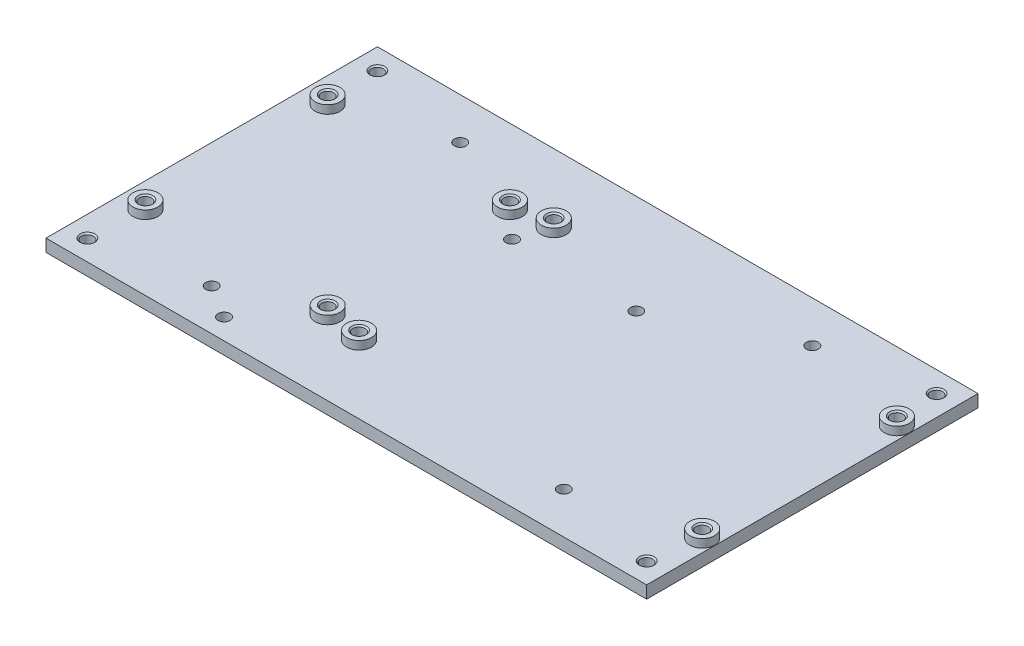
from build123d import *

# Parameters (mm, degrees)
SKETCH_1_W                     = 145
SKETCH_1_H                     = 80
EXTRUDE_1_DEPTH                = 3
SKETCH_3_R                     = 3
EXTRUDE_2_DEPTH                = 2
HOLE_WIZARD_M3_5_4_D           = 2.9
HOLE_WIZARD_M3_5_4_DEPTH       = 11.2
HOLE_WIZARD_M3_5_4_CSINK_D     = 3.55
HOLE_WIZARD_M3_5_4_CSINK_ANGLE = 90
HOLE_WIZARD_M3_5_4_TIP         = 0.871247898
HOLE_WIZARD_M3_5_5_D           = 2.9
HOLE_WIZARD_M3_5_5_DEPTH       = 7
HOLE_WIZARD_M3_5_5_CSINK_D     = 3.55
HOLE_WIZARD_M3_5_5_CSINK_ANGLE = 90
HOLE_WIZARD_M3_5_5_TIP         = 0.871247898
HOLE_WIZARD_M3_5_7_D           = 2.9
HOLE_WIZARD_M3_5_7_CSINK_D     = 3.55
HOLE_WIZARD_M3_5_7_CSINK_ANGLE = 90


with BuildPart() as part:
    # 草图1 → 凸台-拉伸1 (new body)
    with BuildSketch(Plane(origin=(0, 0, 0), x_dir=(1, 0, 0), z_dir=(0, 1, 0))):
        with Locations((72.5, 40)):
            Rectangle(SKETCH_1_W, SKETCH_1_H)
    extrude(amount=EXTRUDE_1_DEPTH)

    # 草图3 → 凸台-拉伸2 (add)
    with BuildSketch(Plane(origin=(0, 3, 0), x_dir=(1, 0, 0), z_dir=(0, 1, 0))):
        with Locations(Location((59.085, 63.5, 0), (0, 0, 90))):
            Circle(SKETCH_3_R)
        with Locations(Location((59.085, 16.5, 0), (0, 0, 90))):
            Circle(SKETCH_3_R)
        with Locations(Location((141.915, 16.5, 0), (0, 0, 90))):
            Circle(SKETCH_3_R)
        with Locations(Location((141.915, 63.5, 0), (0, 0, 90))):
            Circle(SKETCH_3_R)
        with Locations(Location((6, 62, 0), (0, 0, 90))):
            Circle(SKETCH_3_R)
        with Locations(Location((50, 62, 0), (0, 0, 90))):
            Circle(SKETCH_3_R)
        with Locations(Location((6, 18, 0), (0, 0, 90))):
            Circle(SKETCH_3_R)
        with Locations(Location((50, 18, 0), (0, 0, 90))):
            Circle(SKETCH_3_R)
    extrude(amount=EXTRUDE_2_DEPTH)

    # M3.5 螺纹孔4
    with Locations(Plane(origin=(0, 5, 0), x_dir=(1, 0, 0), z_dir=(0, 1, 0))):
        with Locations((141.915, 63.5), (6, 62), (50, 62), (59.085, 63.5), (50, 18), (6, 18), (141.915, 16.5), (59.085, 16.5)):
            CounterSinkHole(HOLE_WIZARD_M3_5_4_D / 2, HOLE_WIZARD_M3_5_4_CSINK_D / 2, depth=HOLE_WIZARD_M3_5_4_DEPTH, counter_sink_angle=HOLE_WIZARD_M3_5_4_CSINK_ANGLE)
            with Locations((0, 0, -(HOLE_WIZARD_M3_5_4_DEPTH + HOLE_WIZARD_M3_5_4_TIP / 2))):  # 118° drill point
                Cone(0, HOLE_WIZARD_M3_5_4_D / 2, HOLE_WIZARD_M3_5_4_TIP, mode=Mode.SUBTRACT)

    # M3.5 螺纹孔5
    with Locations(Plane.XZ):
        with Locations((86.5, -56), (38, -5), (30, -70), (115, -70), (115, -10), (30, -10), (56.5, -56)):
            CounterSinkHole(HOLE_WIZARD_M3_5_5_D / 2, HOLE_WIZARD_M3_5_5_CSINK_D / 2, depth=HOLE_WIZARD_M3_5_5_DEPTH, counter_sink_angle=HOLE_WIZARD_M3_5_5_CSINK_ANGLE)
            with Locations((0, 0, -(HOLE_WIZARD_M3_5_5_DEPTH + HOLE_WIZARD_M3_5_5_TIP / 2))):  # 118° drill point
                Cone(0, HOLE_WIZARD_M3_5_5_D / 2, HOLE_WIZARD_M3_5_5_TIP, mode=Mode.SUBTRACT)

    # M3.5 螺纹孔7 (through all)
    with Locations(Plane(origin=(0, 3, 0), x_dir=(1, 0, 0), z_dir=(0, 1, 0))):
        with Locations((5, 75), (140, 75), (140, 5), (5, 5)):
            CounterSinkHole(HOLE_WIZARD_M3_5_7_D / 2, HOLE_WIZARD_M3_5_7_CSINK_D / 2, counter_sink_angle=HOLE_WIZARD_M3_5_7_CSINK_ANGLE)


solid = part.part
